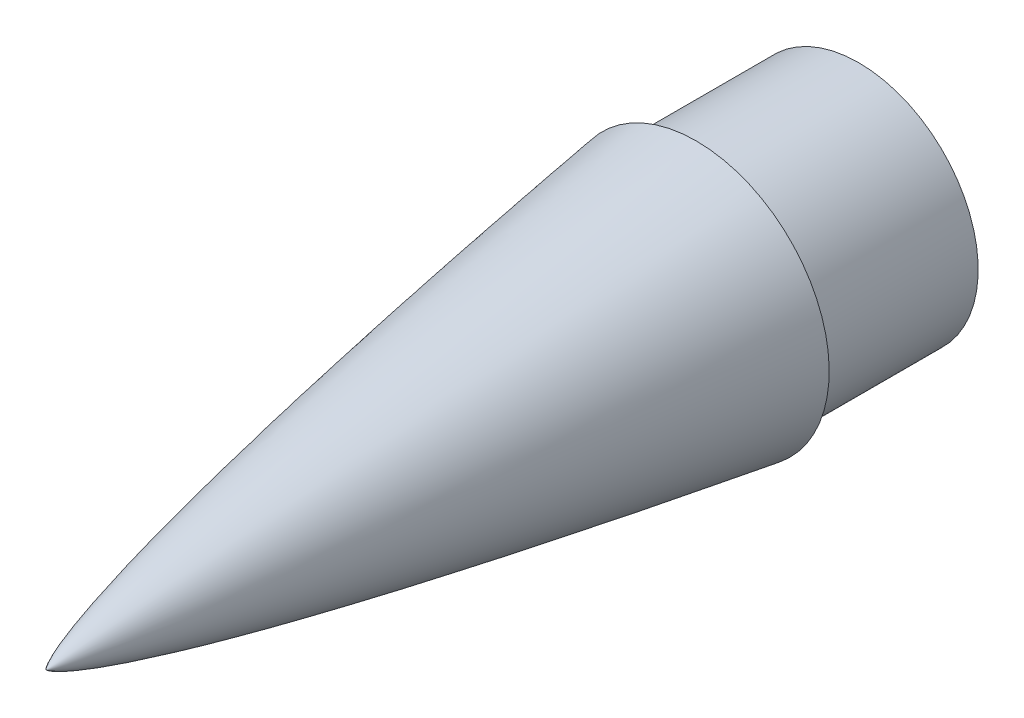
from build123d import *

# Parameters (mm, degrees)
SKETCH2_R                   = 13.992471897
BOSS_EXTRUDE1_DEPTH         = 19.05
F_1_4_20_TAPPED_HOLE1_D     = 5.1054
F_1_4_20_TAPPED_HOLE1_DEPTH = 38.1
F_1_4_20_TAPPED_HOLE1_TIP   = 1.533816902


with BuildPart() as part:
    # Sketch1 → Revolve1 (revolve)
    with BuildSketch(Plane(origin=(0, 0, 0), x_dir=(0, 0, -1), z_dir=(1, 0, 0))):
        with BuildLine():
            Line((76.2, 15.579971897), (76.2, 0))
            Line((76.2, 0), (0, 0))
            add(Edge.make_bspline(
                [(0, 0), (0.002792133, 0.007517657), (0.010102632, 0.021639125), (0.029052268, 0.044540645), (0.058985661, 0.075120576), (0.099333271, 0.110321357), (0.156269016, 0.154766636), (0.239336461, 0.213097121), (0.371995572, 0.296839096), (0.590199779, 0.419955079), (0.965070936, 0.607778944), (1.619855874, 0.897045191), (2.773947, 1.343213722), (4.723814486, 2.000481587), (7.880092454, 2.930618269), (12.115295679, 4.029163257), (17.19406177, 5.217824231), (22.769456129, 6.419578654), (28.368629848, 7.550999177), (33.964865244, 8.624154643), (39.592299094, 9.654907581), (45.189165305, 10.641458188), (50.855832828, 11.604210971), (55.715181086, 12.405681519), (60.047419684, 13.100725468), (63.401347678, 13.631616118), (66.523674112, 14.115542748), (69.466266756, 14.571062691), (73.045302384, 15.109895406), (74.915594162, 15.389572955), (76.2, 15.579971897)],
                knots=[0, 0, 0, 0, 0, 0.000372829, 0.000745658, 0.001374442, 0.002002307, 0.00286818, 0.004118725, 0.006111823, 0.009324733, 0.014564394, 0.023687436, 0.039532586, 0.067072327, 0.110645217, 0.177266519, 0.243887829, 0.310509131, 0.377130436, 0.443751743, 0.510373048, 0.576994355, 0.643615661, 0.710236967, 0.74354762, 0.776858272, 0.810168926, 0.843479579, 0.910100884, 0.910100884, 0.910100884, 0.910100884, 0.910100884], degree=4))
        make_face()
    revolve(axis=Axis((0, 0, -76.2), (0, 0, 1)))

    # Sketch2 → Boss-Extrude1 (add)
    with BuildSketch(Plane(origin=(0, 0, -76.2), x_dir=(-1, 0, 0), z_dir=(0, 0, -1))):
        with Locations(Location((0, 0, 0), (0, 0, 270))):
            Circle(SKETCH2_R)
    extrude(amount=BOSS_EXTRUDE1_DEPTH)

    # 1/4-20 Tapped Hole1
    with Locations(Plane(origin=(0, 0, -95.25), x_dir=(-1, 0, 0), z_dir=(0, 0, -1))):
        with Locations((0, 0)):
            Hole(F_1_4_20_TAPPED_HOLE1_D / 2, depth=F_1_4_20_TAPPED_HOLE1_DEPTH)
            with Locations((0, 0, -(F_1_4_20_TAPPED_HOLE1_DEPTH + F_1_4_20_TAPPED_HOLE1_TIP / 2))):  # 118° drill point
                Cone(0, F_1_4_20_TAPPED_HOLE1_D / 2, F_1_4_20_TAPPED_HOLE1_TIP, mode=Mode.SUBTRACT)


solid = part.part
